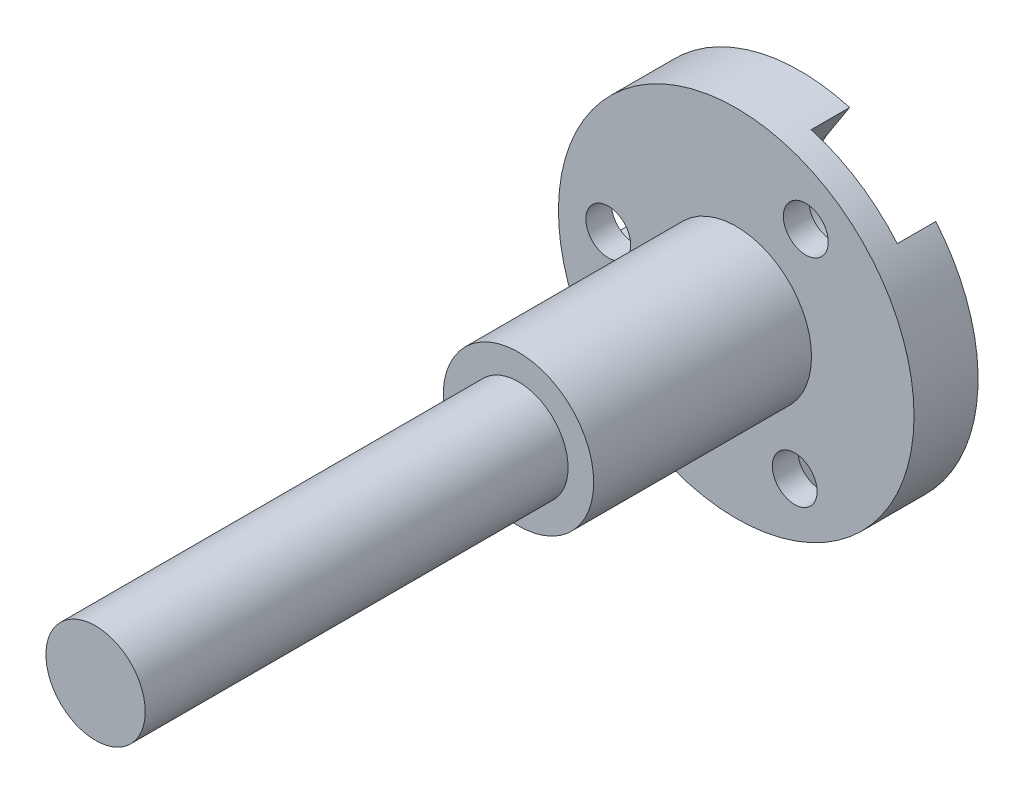
from build123d import *

# Parameters (mm, degrees)
ESQUISSE1_R                  = 13.875
BOSS_EXTRU_1_DEPTH           = 5
ESQUISSE2_R                  = 2.625
ENL_V_MAT_EXTRU_1_DEPTH      = 2
ESQUISSE3_R                  = 3.875
BOSS_EXTRU_2_DEPTH           = 50
ESQUISSE4_R                  = 5.875
BOSS_EXTRU_3_DEPTH           = 17
ENL_V_MAT_EXTRU_2_DEPTH      = 59.395472855
ENL_V_MAT_EXTRU_2_DEPTH_BACK = 59.395472855
ESQUISSE5_R                  = 1.75
ENL_V_MAT_EXTRU_3_DEPTH      = 3


with BuildPart() as part:
    # Esquisse1 → Boss.-Extru.1 (new body)
    with BuildSketch(Plane.XY):
        Circle(ESQUISSE1_R)
    extrude(amount=BOSS_EXTRU_1_DEPTH)

    # Esquisse2 → Enlèv. mat.-Extru.1 (cut)
    with BuildSketch(Plane(origin=(0, 0, 0), x_dir=(-1, 0, 0), z_dir=(0, 0, -1))):
        Circle(ESQUISSE2_R)
    extrude(amount=-ENL_V_MAT_EXTRU_1_DEPTH, mode=Mode.SUBTRACT)

    # Esquisse3 → Boss.-Extru.2 (add)
    with BuildSketch(Plane.XY.offset(5)):
        Circle(ESQUISSE3_R)
    extrude(amount=BOSS_EXTRU_2_DEPTH)

    # Esquisse4 → Boss.-Extru.3 (add)
    with BuildSketch(Plane.XY.offset(5)):
        Circle(ESQUISSE4_R)
    extrude(amount=BOSS_EXTRU_3_DEPTH)

    # Esquisse5 → Enlèv. mat.-Extru.2 (cut, two sides: drawn at the far end of the back side and taken through both)
    with BuildSketch(Plane(origin=(0, 0, 0), x_dir=(-1, 0, 0), z_dir=(0, 0, -1)).offset(-ENL_V_MAT_EXTRU_2_DEPTH_BACK)):
        with Locations((9.987504748, 0.499748848)):
            Circle(ESQUISSE5_R)
        with Locations((-4.560957176, -8.899307256)):
            Circle(ESQUISSE5_R)
        with Locations((-5.426547571, 8.399558408)):
            Circle(ESQUISSE5_R)
    extrude(amount=ENL_V_MAT_EXTRU_2_DEPTH + ENL_V_MAT_EXTRU_2_DEPTH_BACK, mode=Mode.SUBTRACT)

    # Esquisse6 → Enlèv. mat.-Extru.3 (cut)
    with BuildSketch(Plane(origin=(0, 0, 0), x_dir=(-1, 0, 0), z_dir=(0, 0, -1))):
        with BuildLine():
            Line((9.787605209, 4.494750747), (14.846993763, 4.747909435))
            ThreePointArc((14.846993763, 4.747909435), (19.041895201, 0.952807075), (15.246792841, -3.242094364))
            Line((15.246792841, -3.242094364), (10.187404287, -3.495253052))
            ThreePointArc((10.187404287, -3.495253052), (5.992502849, 0.299849309), (9.787605209, 4.494750747))
        make_face()
        with BuildLine():
            Line((-1.001234274, -10.723690126), (-4.262940688, -17.087908521))
            ThreePointArc((-4.262940688, -17.087908521), (-9.647046461, -18.823248552), (-11.382386493, -13.43914278))
            Line((-11.382386493, -13.43914278), (-8.120680079, -7.074924385))
            ThreePointArc((-8.120680079, -7.074924385), (-2.736574306, -5.339584354), (-1.001234274, -10.723690126))
        make_face()
        with BuildLine():
            Line((-8.786370935, 6.22893938), (-13.208101845, 13.073178107))
            ThreePointArc((-13.208101845, 13.073178107), (-12.01889751, 18.603620499), (-6.488455118, 17.414416164))
            Line((-6.488455118, 17.414416164), (-2.066724208, 10.570177437))
            ThreePointArc((-2.066724208, 10.570177437), (-3.255928543, 5.039735045), (-8.786370935, 6.22893938))
        make_face()
    extrude(amount=-ENL_V_MAT_EXTRU_3_DEPTH, mode=Mode.SUBTRACT)


solid = part.part
